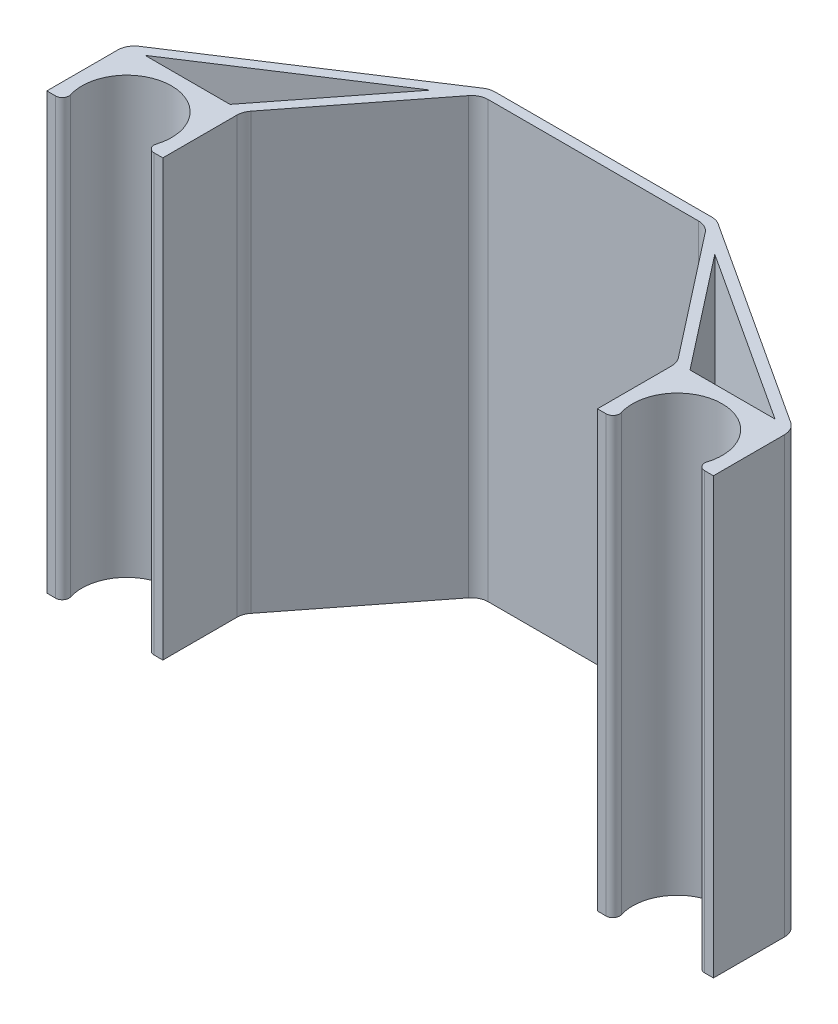
from build123d import *

# Parameters (mm, degrees)
BOSS_EXTRUDE1_DEPTH = 130.5
FILLET1_R           = 5


with BuildPart() as part:
    # Sketch1 → Boss-Extrude1 (new body)
    with BuildSketch(Plane(origin=(0, 0, 0), x_dir=(1, 0, 0), z_dir=(0, 1, 0))):
        with BuildLine():
            Line((0, 0), (-34, 0))
            Line((-34, 0), (-100, -43))
            Line((-100, -43), (-100, -66.97))
            Line((-100, -66.97), (-97.358644924, -66.97))
            ThreePointArc((-97.358644924, -66.97), (-95.748804634, -66.156766295), (-95.448140727, -64.378414239))
            ThreePointArc((-95.448140727, -64.378414239), (-82.6, -46.95), (-69.751859273, -64.378414239))
            ThreePointArc((-69.751859273, -64.378414239), (-69.451195366, -66.156766295), (-67.841355076, -66.97))
            Line((-67.841355076, -66.97), (-65.2, -66.97))
            Line((-65.2, -66.97), (-65.2, -43))
            Line((-65.2, -43), (-34, -3))
            Line((-34, -3), (0, -3))
            Line((0, -3), (0, 0))
        make_face()
        Polygon((-69.004681327, -43), (-94.504291462, -43), (-42.656655328, -9.220479488), align=None, mode=Mode.SUBTRACT)
    boss_extrude1 = extrude(amount=BOSS_EXTRUDE1_DEPTH)

    # Mirror1: Boss-Extrude1 across plane
    add(boss_extrude1.mirror(Plane(origin=(0, 130.5, 3), x_dir=(0, 0, 1), z_dir=(-1, 0, 0))))

    # Fillet1
    fillet1_edges = [part.edges().sort_by_distance(p)[0] for p in [
        (-34, 65.25, 3),
        (-65.2, 65.25, 43),
        (-100, 65.25, 43),
        (-34, 65.25, 0),
        (34, 65.25, 3),
        (65.2, 65.25, 43),
        (100, 65.25, 43),
        (34, 65.25, 0),
    ]]
    fillet(fillet1_edges, radius=FILLET1_R)


solid = part.part
